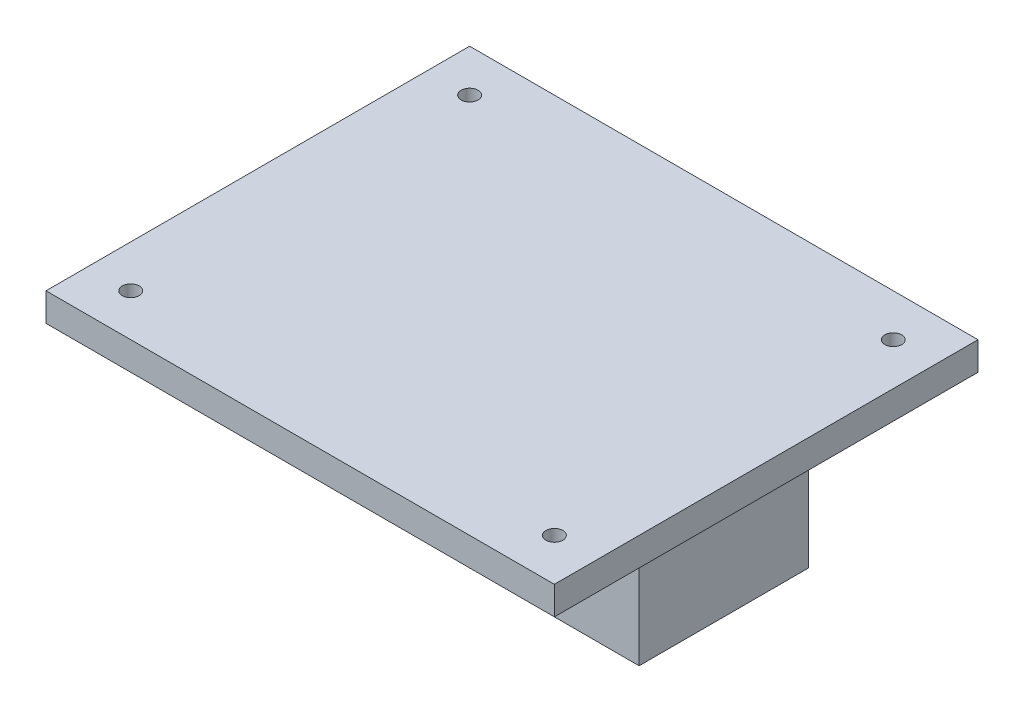
from build123d import *

# Parameters (mm, degrees)
IZIM1_W                     = 180
IZIM1_H                     = 150
Y_KSEKLIK_EKSTR_ZYON1_DEPTH = 10
IZIM2_R                     = 3
KES_EKSTR_ZYON1_DEPTH       = 35
IZIM3_W                     = 30
IZIM3_H                     = 60
Y_KSEKLIK_EKSTR_ZYON2_DEPTH = 45
IZIM5_W                     = 15
IZIM5_H                     = 3
KES_EKSTR_ZYON2_DEPTH       = 50
IZIM7_W                     = 15
IZIM7_H                     = 3
KES_EKSTR_ZYON3_DEPTH       = 50


with BuildPart() as part:
    # Çizim1 → Yükseklik-Ekstrüzyon1 (new body)
    with BuildSketch(Plane(origin=(0, 0, 0), x_dir=(1, 0, 0), z_dir=(0, 1, 0))):
        Rectangle(IZIM1_W, IZIM1_H)
    extrude(amount=Y_KSEKLIK_EKSTR_ZYON1_DEPTH)

    # Çizim2 → Kes-Ekstrüzyon1 (cut)
    with BuildSketch(Plane(origin=(0, 10, 0), x_dir=(1, 0, 0), z_dir=(0, 1, 0))):
        with Locations(Location((-75, 60, 0), (0, 0, 270))):
            Circle(IZIM2_R)
        with Locations(Location((-75, -60, 0), (0, 0, 270))):
            Circle(IZIM2_R)
        with Locations(Location((75, -60, 0), (0, 0, 270))):
            Circle(IZIM2_R)
        with Locations(Location((75, 60, 0), (0, 0, 270))):
            Circle(IZIM2_R)
    extrude(amount=-KES_EKSTR_ZYON1_DEPTH, mode=Mode.SUBTRACT)

    # Çizim3 → Yükseklik-Ekstrüzyon2 (add)
    with BuildSketch(Plane.XZ):
        with Locations((-60, 0)):
            Rectangle(IZIM3_W, IZIM3_H)
        with Locations((60, 0)):
            Rectangle(IZIM3_W, IZIM3_H)
    extrude(amount=Y_KSEKLIK_EKSTR_ZYON2_DEPTH)

    # Çizim5 → Kes-Ekstrüzyon2 (cut)
    with BuildSketch(Plane(origin=(0, 0, -30), x_dir=(-1, 0, 0), z_dir=(0, 0, -1))):
        with Locations((60, -43.5)):
            Rectangle(IZIM5_W, IZIM5_H)
    extrude(amount=-KES_EKSTR_ZYON2_DEPTH, mode=Mode.SUBTRACT)

    # Çizim7 → Kes-Ekstrüzyon3 (cut)
    with BuildSketch(Plane(origin=(0, 0, -30), x_dir=(-1, 0, 0), z_dir=(0, 0, -1))):
        with Locations((-60, -43.5)):
            Rectangle(IZIM7_W, IZIM7_H)
    extrude(amount=-KES_EKSTR_ZYON3_DEPTH, mode=Mode.SUBTRACT)


solid = part.part
